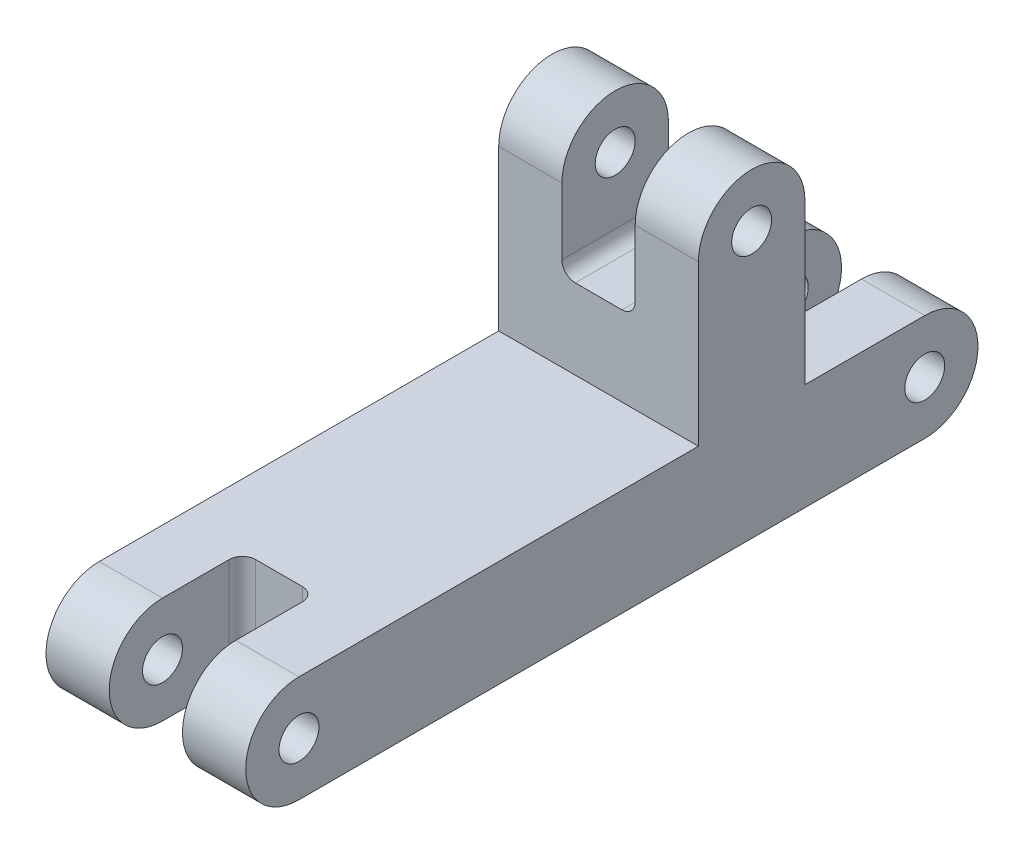
from build123d import *

# Parameters (mm, degrees)
CROQUIS1_R              = 1.5
SALIENTE_EXTRUIR1_DEPTH = 7.5
CROQUIS2_W              = 8
CROQUIS2_H              = 10
CROQUIS2_W_2            = 16
CROQUIS2_H_2            = 8
CROQUIS2_W_3            = 10
CORTAR_EXTRUIR1_DEPTH   = 2.75
REDONDEO1_R             = 1


with BuildPart() as part:
    # Croquis1 → Saliente-Extruir1 (new, symmetric)
    with BuildSketch(Plane(origin=(0, 0, 0), x_dir=(0, 0, -1), z_dir=(1, 0, 0))):
        with BuildLine():
            Line((-4.5, -4), (4.5, -4))
            ThreePointArc((4.5, -4), (8.5, 0), (4.5, 4))
            Line((4.5, 4), (-4.5, 4))
            Line((-4.5, 4), (-4.5, 16))
            ThreePointArc((-4.5, 16), (-8.5, 20), (-12.5, 16))
            Line((-12.5, 16), (-12.5, 4))
            Line((-12.5, 4), (-42.5, 4))
            ThreePointArc((-42.5, 4), (-46.5, 0), (-42.5, -4))
            Line((-42.5, -4), (-4.5, -4))
        make_face()
        with Locations((4.5, 0)):
            Circle(CROQUIS1_R, mode=Mode.SUBTRACT)
        with Locations((-8.5, 16)):
            Circle(CROQUIS1_R, mode=Mode.SUBTRACT)
        with Locations((-42.5, 0)):
            Circle(CROQUIS1_R, mode=Mode.SUBTRACT)
    extrude(amount=SALIENTE_EXTRUIR1_DEPTH, both=True)

    # Croquis2 → Cortar-Extruir1 (cut, symmetric)
    with BuildSketch(Plane(origin=(0, 0, 0), x_dir=(0, 0, -1), z_dir=(1, 0, 0))):
        with Locations((-8.5, 15)):
            Rectangle(CROQUIS2_W, CROQUIS2_H)
        with Locations((0.5, 0)):
            Rectangle(CROQUIS2_W_2, CROQUIS2_H_2)
        with Locations((-41.5, 0)):
            Rectangle(CROQUIS2_W_3, CROQUIS2_H_2)
    extrude(amount=CORTAR_EXTRUIR1_DEPTH, both=True, mode=Mode.SUBTRACT)

    # Redondeo1
    redondeo1_edges = [part.edges().sort_by_distance(p)[0] for p in [
        (2.75, 10, 8.5),
        (-2.75, 10, 8.5),
        (2.75, 0, 36.5),
        (-2.75, 0, 36.5),
        (2.75, 0, 7.5),
        (-2.75, 0, 7.5),
    ]]
    fillet(redondeo1_edges, radius=REDONDEO1_R)


solid = part.part
